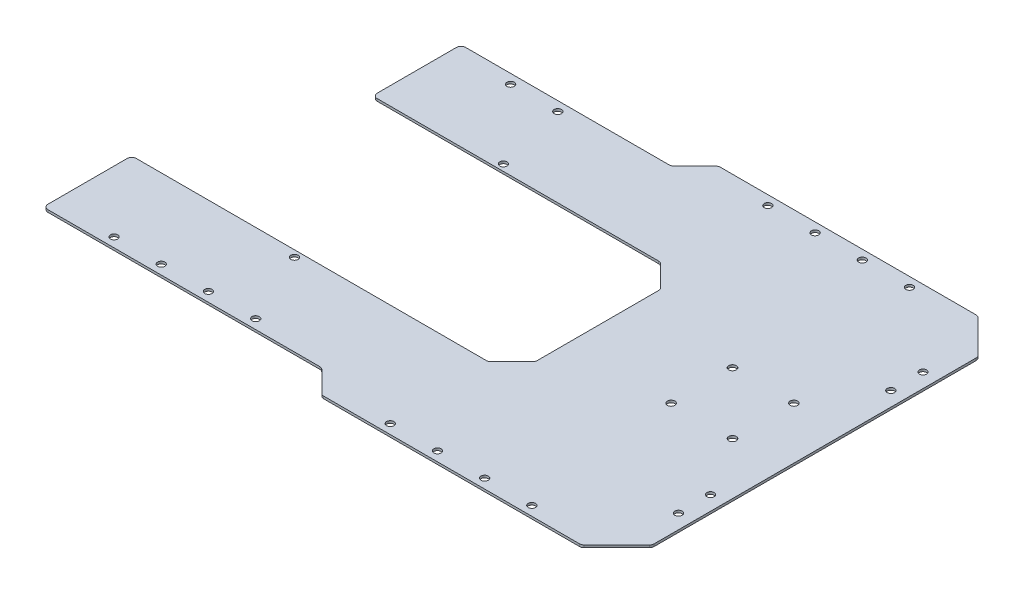
from build123d import *

# Parameters (mm, degrees)
SKETCH_1_W          = 70
SKETCH_1_H          = 70
SKETCH_1_R          = 1.6
EXTRUDE_1_DEPTH     = 1
EXTRUDE_2_DEPTH     = 1
SKETCH_5_R          = 1.55
CUT_EXTRUDE_1_DEPTH = 10
SKETCH_6_R          = 1.55
CUT_EXTRUDE_2_DEPTH = 10
CHAMFER_1_SIZE      = 10
FILLET_1_R          = 2


with BuildPart() as part:
    # 草图1 → 凸台-拉伸1 (new body)
    with BuildSketch(Plane(origin=(0, 0, 0), x_dir=(1, 0, 0), z_dir=(0, 1, 0))):
        Rectangle(SKETCH_1_W, SKETCH_1_H)
        with Locations(Location((13, -13, 0), (0, 0, 270))):
            Circle(SKETCH_1_R, mode=Mode.SUBTRACT)
        with Locations(Location((13, 13, 0), (0, 0, 270))):
            Circle(SKETCH_1_R, mode=Mode.SUBTRACT)
        with Locations(Location((-13, 13, 0), (0, 0, 270))):
            Circle(SKETCH_1_R, mode=Mode.SUBTRACT)
        with Locations(Location((-13, -13, 0), (0, 0, 270))):
            Circle(SKETCH_1_R, mode=Mode.SUBTRACT)
    extrude(amount=EXTRUDE_1_DEPTH)

    # 草图2 → 凸台-拉伸2 (add)
    with BuildSketch(Plane.XZ):
        Polygon((35, -35), (35, -69), (20, -84), (-90, -84), (-100, -74), (-189, -74), (-189, -36.5), (-57, -36.5), (-57, 36.5), (-218, 36.5), (-218, 74), (-100, 74), (-90, 84), (20, 84), (35, 69), (35, 35), (-35, 35), (-35, -35), align=None)
    extrude(amount=-EXTRUDE_2_DEPTH)

    # 草图5 → 切除-拉伸1 (cut)
    with BuildSketch(Plane(origin=(0, 1, 0), x_dir=(1, 0, 0), z_dir=(0, 1, 0))):
        with Locations(Location((-146.3, -39.25, 0), (0, 0, 270))):
            Circle(SKETCH_5_R)
        with Locations(Location((-136.3, 39.25, 0), (0, 0, 270))):
            Circle(SKETCH_5_R)
    extrude(amount=-CUT_EXTRUDE_1_DEPTH, mode=Mode.SUBTRACT)

    # 草图6 → 切除-拉伸2 (cut)
    with BuildSketch(Plane.XZ):
        with Locations(Location((28.9, 51.8, 0), (0, 0, 270))):
            Circle(SKETCH_6_R)
        with Locations(Location((28.9, 38.2, 0), (0, 0, 270))):
            Circle(SKETCH_6_R)
        with Locations(Location((28.9, -51.8, 0), (0, 0, 270))):
            Circle(SKETCH_6_R)
        with Locations(Location((28.9, -38.2, 0), (0, 0, 270))):
            Circle(SKETCH_6_R)
        with Locations(Location((-5, 80, 0), (0, 0, 270))):
            Circle(SKETCH_6_R)
        with Locations(Location((-25, 80, 0), (0, 0, 270))):
            Circle(SKETCH_6_R)
        with Locations(Location((-132, 70, 0), (0, 0, 270))):
            Circle(SKETCH_6_R)
        with Locations(Location((-152, 70, 0), (0, 0, 270))):
            Circle(SKETCH_6_R)
        with Locations(Location((-144, -70, 0), (0, 0, 270))):
            Circle(SKETCH_6_R)
        with Locations(Location((-164, -70, 0), (0, 0, 270))):
            Circle(SKETCH_6_R)
        with Locations(Location((-5, -80, 0), (0, 0, 270))):
            Circle(SKETCH_6_R)
        with Locations(Location((-25, -80, 0), (0, 0, 270))):
            Circle(SKETCH_6_R)
        with Locations(Location((-45, 80, 0), (0, 0, 270))):
            Circle(SKETCH_6_R)
        with Locations(Location((-65, 80, 0), (0, 0, 270))):
            Circle(SKETCH_6_R)
        with Locations(Location((-45, -80, 0), (0, 0, 270))):
            Circle(SKETCH_6_R)
        with Locations(Location((-65, -80, 0), (0, 0, 270))):
            Circle(SKETCH_6_R)
        with Locations(Location((-192, 70, 0), (0, 0, 270))):
            Circle(SKETCH_6_R)
        with Locations(Location((-172, 70, 0), (0, 0, 270))):
            Circle(SKETCH_6_R)
    extrude(amount=-CUT_EXTRUDE_2_DEPTH, mode=Mode.SUBTRACT)

    # 倒角1
    chamfer_1_edges = [part.edges().sort_by_distance(p)[0] for p in [
        (-57, 0.5, -36.5),
        (-57, 0.5, 36.5),
    ]]
    chamfer(chamfer_1_edges, length=CHAMFER_1_SIZE)

    # 圆角1
    fillet_1_edges = [part.edges().sort_by_distance(p)[0] for p in [
        (-57, 0.5, 26.5),
        (-57, 0.5, -26.5),
        (-67, 0.5, -36.5),
        (-67, 0.5, 36.5),
        (35, 0.5, -69),
        (20, 0.5, -84),
        (-90, 0.5, -84),
        (-100, 0.5, -74),
        (-189, 0.5, -74),
        (-189, 0.5, -36.5),
        (-218, 0.5, 36.5),
        (-218, 0.5, 74),
        (-100, 0.5, 74),
        (-90, 0.5, 84),
        (20, 0.5, 84),
        (35, 0.5, 69),
    ]]
    fillet(fillet_1_edges, radius=FILLET_1_R)


solid = part.part
